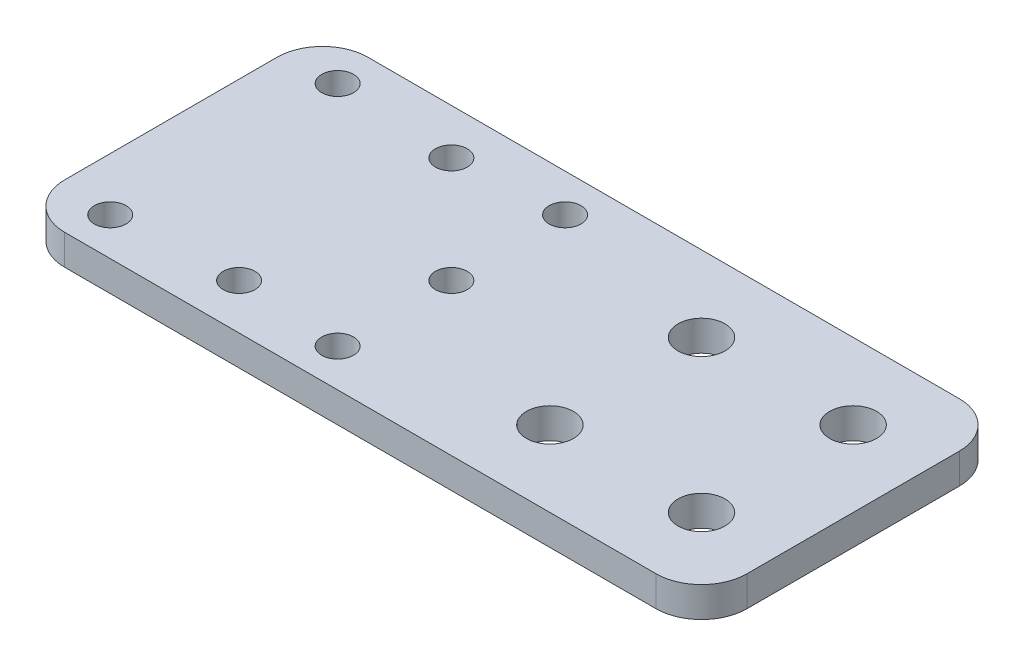
from build123d import *

# Parameters (mm, degrees)
SKETCH_1_W      = 45
SKETCH_1_H      = 20
SKETCH_1_R      = 1.55
SKETCH_1_R_2    = 1.05
EXTRUDE_1_DEPTH = 2
FILLET_1_R      = 3


with BuildPart() as part:
    # 草图1 → 凸台-拉伸1 (new body)
    with BuildSketch(Plane(origin=(0, 0, 0), x_dir=(1, 0, 0), z_dir=(0, 1, 0))):
        with Locations((22.5, 10)):
            Rectangle(SKETCH_1_W, SKETCH_1_H)
        with Locations(Location((30, 15, 0), (0, 0, 270))):
            Circle(SKETCH_1_R, mode=Mode.SUBTRACT)
        with Locations(Location((40, 15, 0), (0, 0, 270))):
            Circle(SKETCH_1_R, mode=Mode.SUBTRACT)
        with Locations(Location((40, 5, 0), (0, 0, 270))):
            Circle(SKETCH_1_R, mode=Mode.SUBTRACT)
        with Locations(Location((30, 5, 0), (0, 0, 270))):
            Circle(SKETCH_1_R, mode=Mode.SUBTRACT)
        with Locations(Location((11.5, 17, 0), (0, 0, 270))):
            Circle(SKETCH_1_R_2, mode=Mode.SUBTRACT)
        with Locations(Location((18.5, 10, 0), (0, 0, 270))):
            Circle(SKETCH_1_R_2, mode=Mode.SUBTRACT)
        with Locations(Location((11.5, 3, 0), (0, 0, 270))):
            Circle(SKETCH_1_R_2, mode=Mode.SUBTRACT)
        with Locations(Location((3.5, 17.5, 0), (0, 0, 270))):
            Circle(SKETCH_1_R_2, mode=Mode.SUBTRACT)
        with Locations(Location((18.5, 17.5, 0), (0, 0, 270))):
            Circle(SKETCH_1_R_2, mode=Mode.SUBTRACT)
        with Locations(Location((18.5, 2.5, 0), (0, 0, 270))):
            Circle(SKETCH_1_R_2, mode=Mode.SUBTRACT)
        with Locations(Location((3.5, 2.5, 0), (0, 0, 270))):
            Circle(SKETCH_1_R_2, mode=Mode.SUBTRACT)
    extrude(amount=EXTRUDE_1_DEPTH)

    # 圆角1
    fillet_1_edges = [part.edges().sort_by_distance(p)[0] for p in [
        (0, 1, -20),
        (45, 1, -20),
        (45, 1, 0),
        (0, 1, 0),
    ]]
    fillet(fillet_1_edges, radius=FILLET_1_R)


solid = part.part
